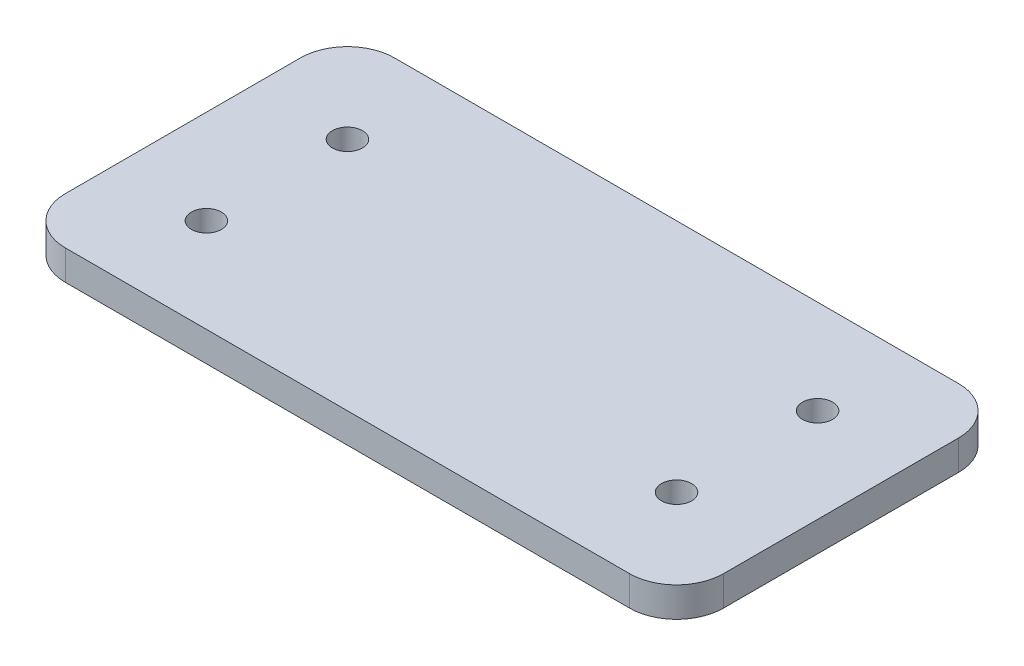
from build123d import *

# Parameters (mm, degrees)
SKETCH1_W           = 70
SKETCH1_H           = 35
BOSS_EXTRUDE1_DEPTH = 3.175
SKETCH2_R           = 1.6
CUT_EXTRUDE1_DEPTH  = 3.175
FILLET1_R           = 5


with BuildPart() as part:
    # Sketch1 → Boss-Extrude1 (new body)
    with BuildSketch(Plane(origin=(0, 0, 0), x_dir=(1, 0, 0), z_dir=(0, 1, 0))):
        Rectangle(SKETCH1_W, SKETCH1_H)
    extrude(amount=BOSS_EXTRUDE1_DEPTH)

    # Sketch2 → Cut-Extrude1 (cut)
    with BuildSketch(Plane(origin=(0, 3.175, 0), x_dir=(1, 0, 0), z_dir=(0, 1, 0))):
        with Locations(Location((-25, 7.5, 0), (0, 0, 270))):
            Circle(SKETCH2_R)
        with Locations(Location((-25, -7.5, 0), (0, 0, 270))):
            Circle(SKETCH2_R)
        with Locations(Location((25, -7.5, 0), (0, 0, 270))):
            Circle(SKETCH2_R)
        with Locations(Location((25, 7.5, 0), (0, 0, 270))):
            Circle(SKETCH2_R)
    extrude(amount=-CUT_EXTRUDE1_DEPTH, mode=Mode.SUBTRACT)

    # Fillet1
    fillet1_edges = [part.edges().sort_by_distance(p)[0] for p in [
        (35, 1.5875, 17.5),
        (-35, 1.5875, 17.5),
        (-35, 1.5875, -17.5),
        (35, 1.5875, -17.5),
    ]]
    fillet(fillet1_edges, radius=FILLET1_R)


solid = part.part
